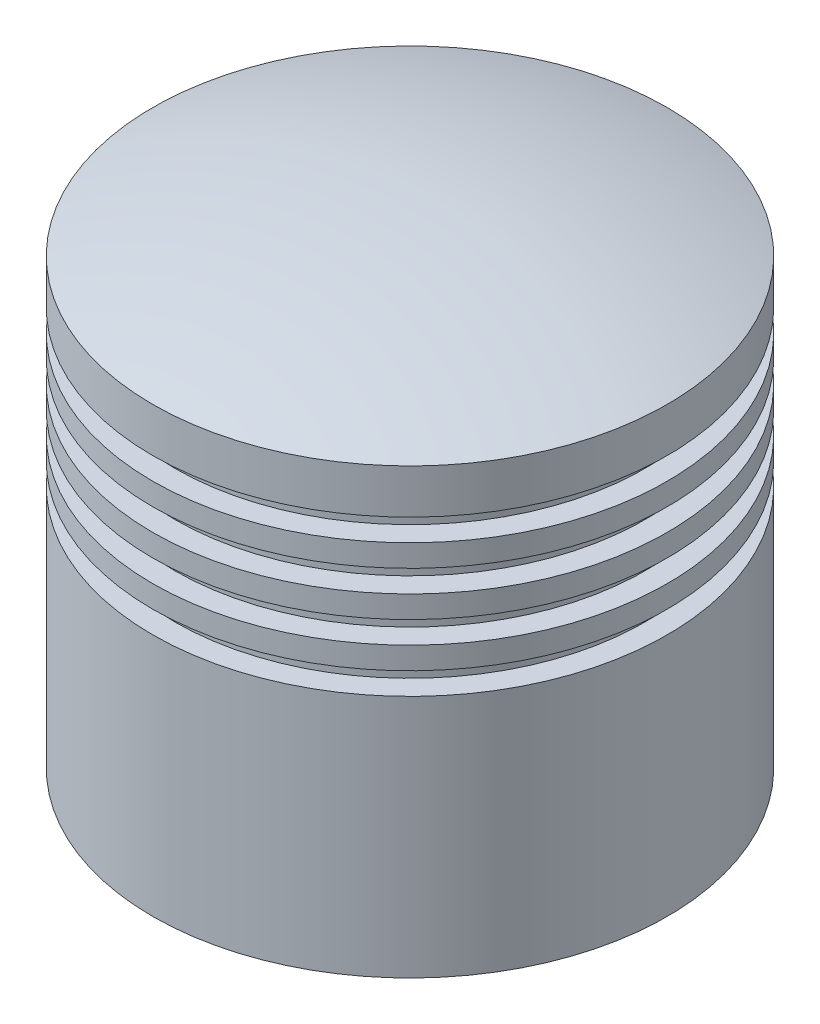
from build123d import *


with BuildPart() as part:
    # Sketch2 → Revolve1 (revolve)
    with BuildSketch(Plane.XY, mode=Mode.PRIVATE) as revolve1_sk:
        with BuildLine():
            Line((43, 97.376742064), (43, 30))
            Line((43, 30), (50, 30))
            Line((50, 30), (50, 0))
            Line((50, 0), (58, 0))
            Line((58, 0), (58, 55))
            Line((58, 55), (53, 55))
            Line((53, 55), (53, 60))
            Line((53, 60), (58, 60))
            Line((58, 60), (58, 65))
            Line((58, 65), (53, 65))
            Line((53, 65), (53, 70))
            Line((53, 70), (58, 70))
            Line((58, 70), (58, 75))
            Line((58, 75), (53, 75))
            Line((53, 75), (53, 80))
            Line((53, 80), (58, 80))
            Line((58, 80), (58, 85))
            Line((58, 85), (53, 85))
            Line((53, 85), (53, 90))
            Line((53, 90), (58, 90))
            Line((58, 90), (58, 100))
            ThreePointArc((58, 100), (29.436054392, 107.529115473), (0, 110))
            Line((0, 110), (0, 102.99996153))
            ThreePointArc((0, 102.99996153), (21.687841778, 101.624752513), (43, 97.376742064))
        make_face()
    revolve(revolve1_sk.sketch.rotate(Axis((0, 0, 0), (0, 1, 0)), 90), axis=Axis((0, 0, 0), (0, 1, 0)))


solid = part.part
